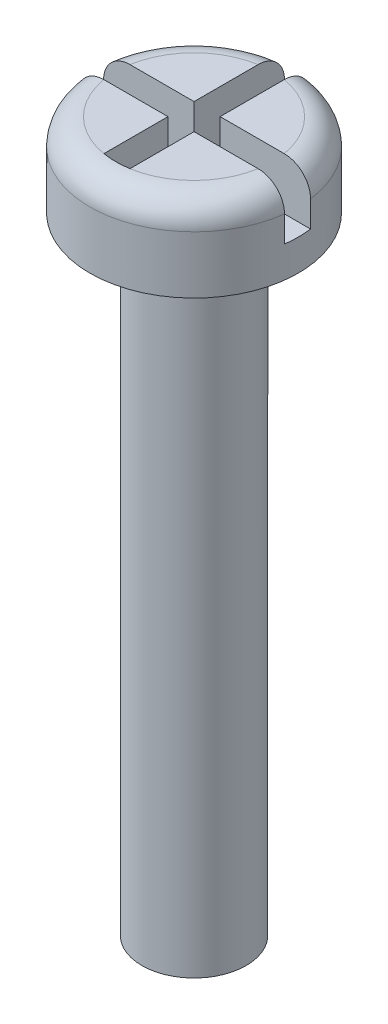
from build123d import *

# Parameters (mm, degrees)
SKETCH1_R           = 2
BOSS_EXTRUDE1_DEPTH = 1.6
FILLET1_R           = 0.5
SKETCH2_R           = 1
BOSS_EXTRUDE2_DEPTH = 12
CUT_EXTRUDE1_DEPTH  = 1


with BuildPart() as part:
    # Sketch1 → Boss-Extrude1 (new body)
    with BuildSketch(Plane(origin=(0, 0, 0), x_dir=(1, 0, 0), z_dir=(0, 1, 0))):
        with Locations(Location((0, 0, 0), (0, 0, 270))):
            Circle(SKETCH1_R)
    extrude(amount=BOSS_EXTRUDE1_DEPTH)

    # Fillet1
    fillet1_edges = [part.edges().sort_by_distance(p)[0] for p in [
        (0, 1.6, -2),
    ]]
    fillet(fillet1_edges, radius=FILLET1_R)

    # Sketch2 → Boss-Extrude2 (add)
    with BuildSketch(Plane.XZ):
        with Locations(Location((0, 0, 0), (0, 0, 90))):
            Circle(SKETCH2_R)
    extrude(amount=BOSS_EXTRUDE2_DEPTH)

    # Sketch3 → Cut-Extrude1 (cut)
    with BuildSketch(Plane(origin=(0, 1.6, 0), x_dir=(1, 0, 0), z_dir=(0, 1, 0))):
        with BuildLine():
            ThreePointArc((0.25, 1.479019946), (0, 1.5), (-0.25, 1.479019946))
            Line((-0.25, 1.479019946), (-0.25, 0.25))
            Line((-0.25, 0.25), (-1.479019946, 0.25))
            ThreePointArc((-1.479019946, 0.25), (-1.5, 0), (-1.479019946, -0.25))
            Line((-1.479019946, -0.25), (-0.25, -0.25))
            Line((-0.25, -0.25), (-0.25, -1.479019946))
            ThreePointArc((-0.25, -1.479019946), (0, -1.5), (0.25, -1.479019946))
            Line((0.25, -1.479019946), (0.25, -0.25))
            Line((0.25, -0.25), (1.479019946, -0.25))
            ThreePointArc((1.479019946, -0.25), (1.494745784, -0.12543939), (1.5, 0))
            ThreePointArc((1.5, 0), (1.494745784, 0.12543939), (1.479019946, 0.25))
            Line((1.479019946, 0.25), (0.25, 0.25))
            Line((0.25, 0.25), (0.25, 1.479019946))
        make_face()
        with BuildLine():
            Line((2, 0.25), (1.479019946, 0.25))
            ThreePointArc((1.479019946, 0.25), (1.494745784, 0.12543939), (1.5, 0))
            ThreePointArc((1.5, 0), (1.494745784, -0.12543939), (1.479019946, -0.25))
            Line((1.479019946, -0.25), (2, -0.25))
            Line((2, -0.25), (2, 0.25))
        make_face()
        with BuildLine():
            ThreePointArc((-1.479019946, -0.25), (-1.5, 0), (-1.479019946, 0.25))
            Line((-1.479019946, 0.25), (-2, 0.25))
            Line((-2, 0.25), (-2, -0.25))
            Line((-2, -0.25), (-1.479019946, -0.25))
        make_face()
        with BuildLine():
            Line((0.25, 2), (-0.25, 2))
            Line((-0.25, 2), (-0.25, 1.479019946))
            ThreePointArc((-0.25, 1.479019946), (0, 1.5), (0.25, 1.479019946))
            Line((0.25, 1.479019946), (0.25, 2))
        make_face()
    extrude(amount=-CUT_EXTRUDE1_DEPTH, mode=Mode.SUBTRACT)


solid = part.part
